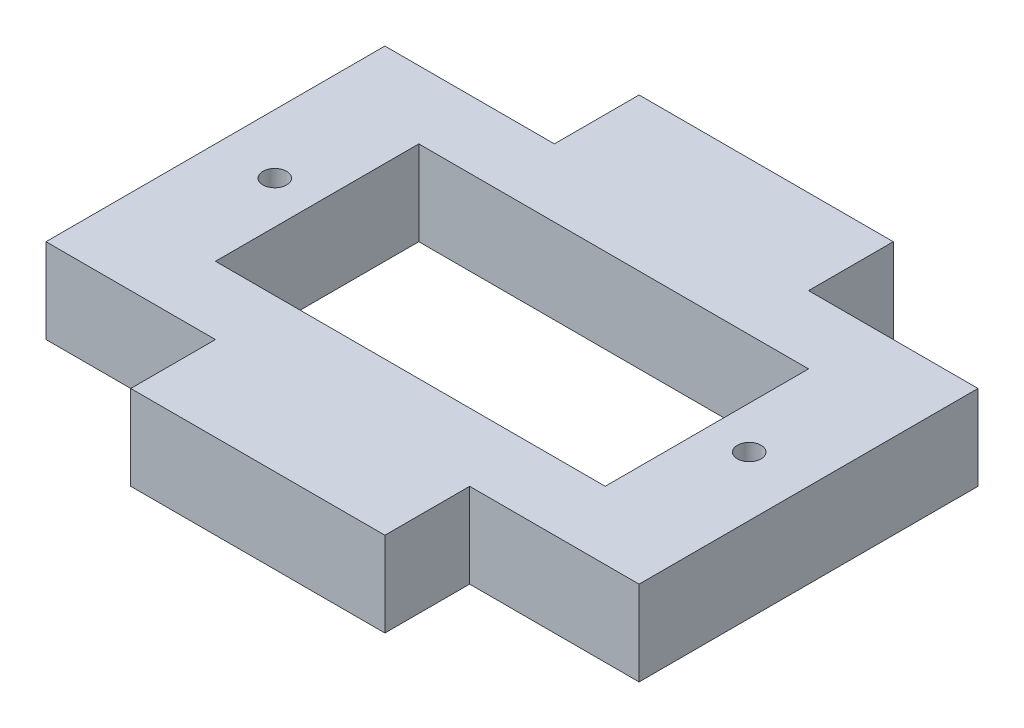
from build123d import *

# Parameters (mm, degrees)
SKETCH1_R           = 0.7
SKETCH1_W           = 23
SKETCH1_H           = 12
BOSS_EXTRUDE1_DEPTH = 5


with BuildPart() as part:
    # Sketch1 → Boss-Extrude1 (new body)
    with BuildSketch(Plane(origin=(0, 0, 0), x_dir=(1, 0, 0), z_dir=(0, 1, 0))):
        Polygon((7.5, 10), (17.5, 10), (17.5, -10), (7.5, -10), (7.5, -15), (-7.5, -15), (-7.5, -10), (-17.5, -10), (-17.5, 10), (-7.5, 10), (-7.5, 15), (7.5, 15), align=None)
        with Locations(Location((-14, 0, 0), (0, 0, 270))):
            Circle(SKETCH1_R, mode=Mode.SUBTRACT)
        with Locations(Location((14, 0, 0), (0, 0, 270))):
            Circle(SKETCH1_R, mode=Mode.SUBTRACT)
        Rectangle(SKETCH1_W, SKETCH1_H, mode=Mode.SUBTRACT)
    extrude(amount=BOSS_EXTRUDE1_DEPTH)


solid = part.part
